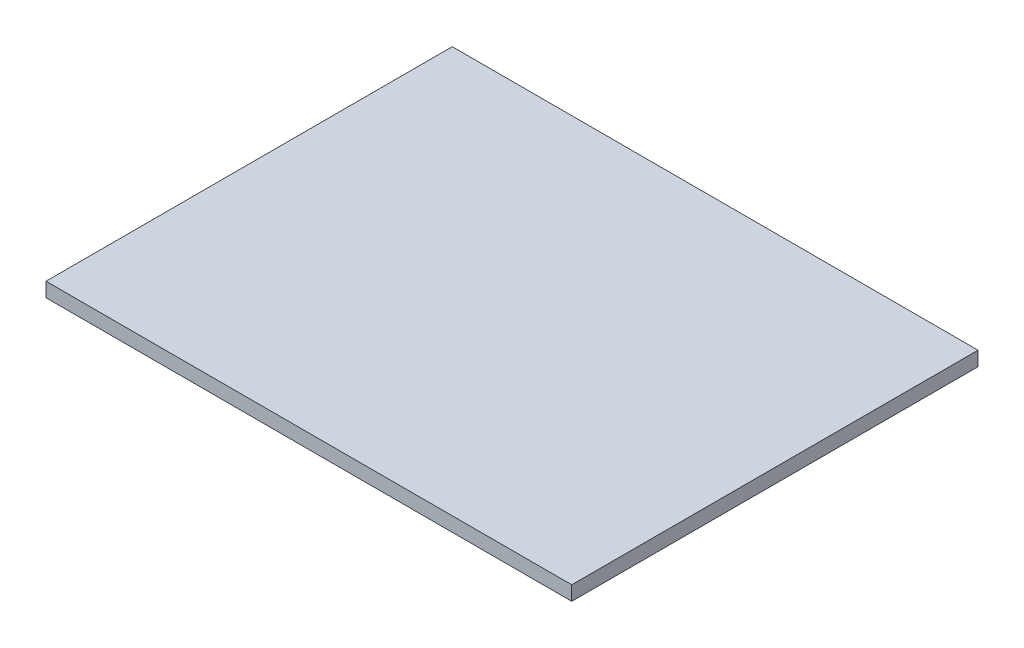
from build123d import *

# Parameters (mm, degrees)
SKETCH1_W           = 110
SKETCH1_H           = 85
BOSS_EXTRUDE1_DEPTH = 3


with BuildPart() as part:
    # Sketch1 → Boss-Extrude1 (new body)
    with BuildSketch(Plane(origin=(0, 0, 0), x_dir=(1, 0, 0), z_dir=(0, 1, 0))):
        Rectangle(SKETCH1_W, SKETCH1_H)
    extrude(amount=BOSS_EXTRUDE1_DEPTH)


solid = part.part
